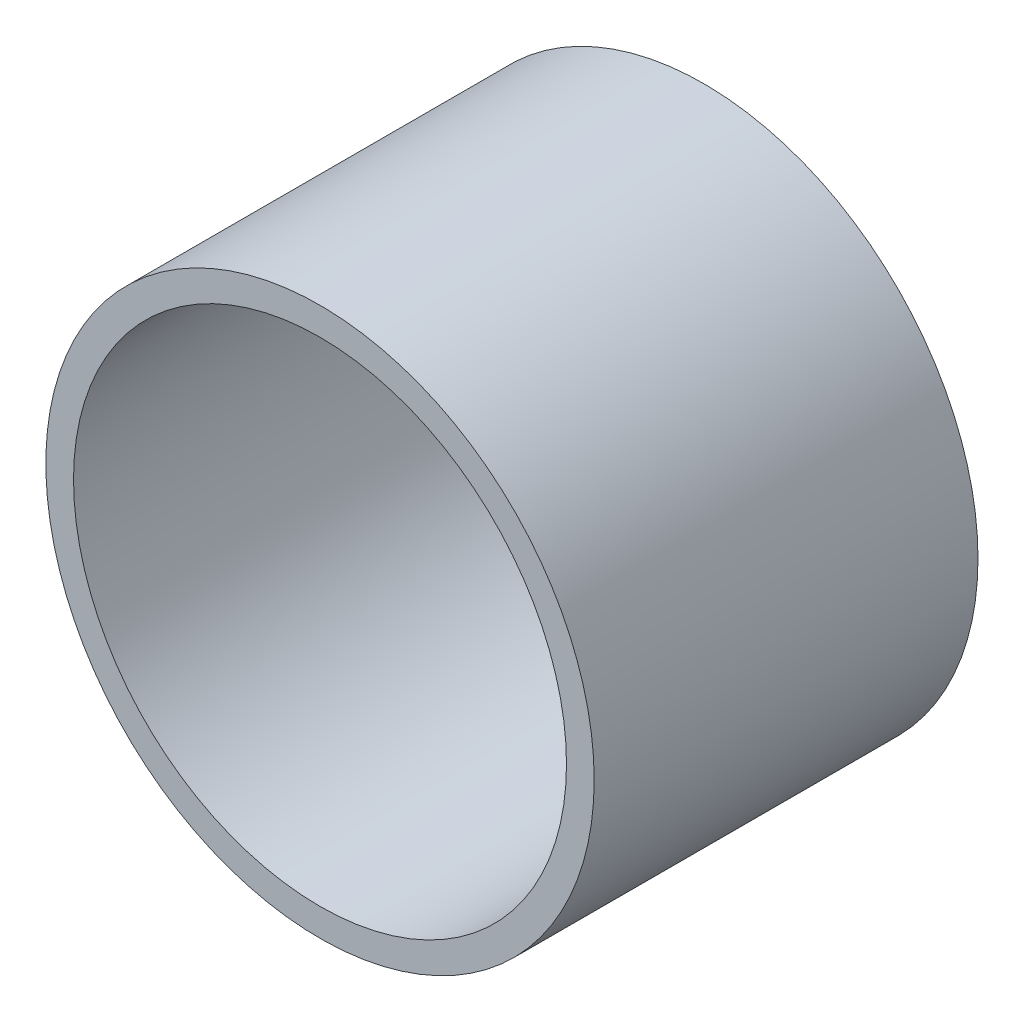
from build123d import *

# Parameters (mm, degrees)
SKETCH1_R           = 25.146
SKETCH1_R_2         = 22.606
BOSS_EXTRUDE1_DEPTH = 35.2


with BuildPart() as part:
    # Sketch1 → Boss-Extrude1 (new body)
    with BuildSketch(Plane.XY):
        Circle(SKETCH1_R)
        Circle(SKETCH1_R_2, mode=Mode.SUBTRACT)
    extrude(amount=BOSS_EXTRUDE1_DEPTH)


solid = part.part
